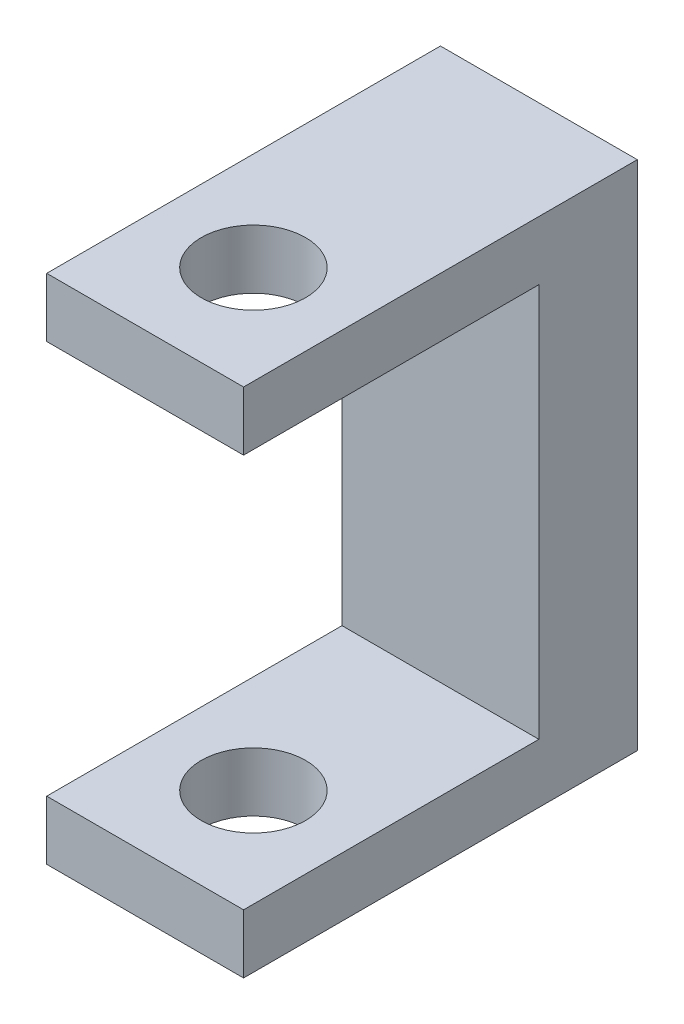
from build123d import *

# Parameters (mm, degrees)
SKETCH2_W           = 26
SKETCH2_H           = 10
BOSS_EXTRUDE1_DEPTH = 20
SKETCH3_W           = 10
SKETCH3_H           = 20
CUT_EXTRUDE1_DEPTH  = 15
SKETCH4_R           = 2.65
CUT_EXTRUDE2_DEPTH  = 34.181320046


with BuildPart() as part:
    # Sketch2 → Boss-Extrude1 (new body)
    with BuildSketch(Plane(origin=(0, 0, 0), x_dir=(0, 1, 0), z_dir=(0, 0, 1))):
        Rectangle(SKETCH2_W, SKETCH2_H)
    extrude(amount=BOSS_EXTRUDE1_DEPTH)

    # Sketch3 → Cut-Extrude1 (cut)
    with BuildSketch(Plane.XY.offset(20)):
        Rectangle(SKETCH3_W, SKETCH3_H)
    extrude(amount=-CUT_EXTRUDE1_DEPTH, mode=Mode.SUBTRACT)

    # Sketch4 → Cut-Extrude2 (cut, through all)
    with BuildSketch(Plane.XZ.offset(13)):
        with Locations(Location((0, 14.5, 0), (0, 0, 270))):
            Circle(SKETCH4_R)
    extrude(amount=-CUT_EXTRUDE2_DEPTH, mode=Mode.SUBTRACT)


solid = part.part
